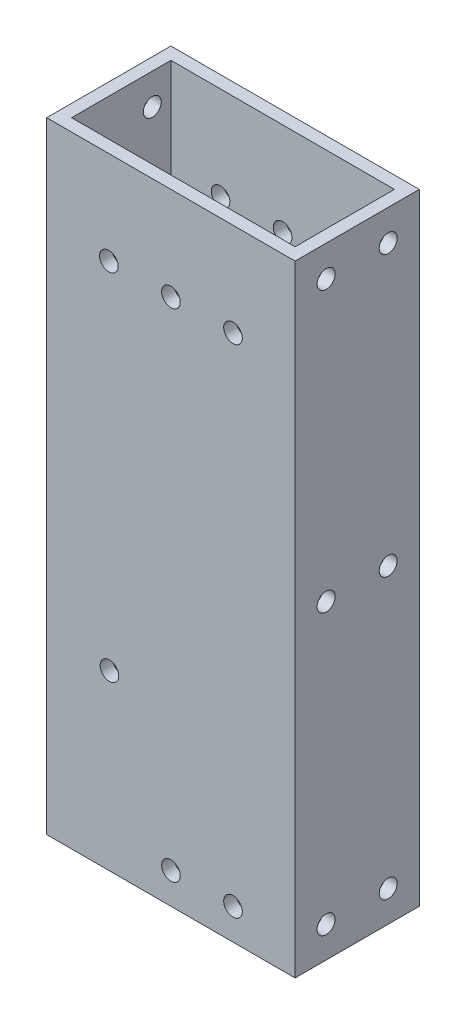
from build123d import *

# Parameters (mm, degrees)
SKETCH_1_W          = 40
SKETCH_1_H          = 20
SKETCH_1_W_2        = 36
SKETCH_1_H_2        = 16
EXTRUDE_1_DEPTH     = 50
SKETCH_2_R          = 1.45
CUT_EXTRUDE_1_DEPTH = 65.807406984
SKETCH_3_R          = 1.5
CUT_EXTRUDE_2_DEPTH = 58.445626465
SKETCH_4_R          = 1.5
CUT_EXTRUDE_3_DEPTH = 58.445626465


with BuildPart() as part:
    # 草图1 → 凸台-拉伸1 (new, symmetric)
    with BuildSketch(Plane(origin=(0, 0, 0), x_dir=(1, 0, 0), z_dir=(0, 1, 0))):
        Rectangle(SKETCH_1_W, SKETCH_1_H)
        Rectangle(SKETCH_1_W_2, SKETCH_1_H_2, mode=Mode.SUBTRACT)
    extrude(amount=EXTRUDE_1_DEPTH, both=True)

    # 草图2 → 切除-拉伸1 (cut, through all)
    with BuildSketch(Plane(origin=(20, 0, 0), x_dir=(0, 0, -1), z_dir=(1, 0, 0))):
        with Locations((5, 45)):
            Circle(SKETCH_2_R)
        with Locations((-5, 45)):
            Circle(SKETCH_2_R)
        with Locations((5, 0)):
            Circle(SKETCH_2_R)
        with Locations((-5, 0)):
            Circle(SKETCH_2_R)
        with Locations((5, -45)):
            Circle(SKETCH_2_R)
        with Locations((-5, -45)):
            Circle(SKETCH_2_R)
    extrude(amount=-CUT_EXTRUDE_1_DEPTH, mode=Mode.SUBTRACT)

    # 草图3 → 切除-拉伸2 (cut, through all)
    with BuildSketch(Plane(origin=(0, 0, -10), x_dir=(-1, 0, 0), z_dir=(0, 0, -1))):
        with Locations((10, 35)):
            Circle(SKETCH_3_R)
        with Locations((0, 35)):
            Circle(SKETCH_3_R)
        with Locations((-10, 35)):
            Circle(SKETCH_3_R)
    extrude(amount=-CUT_EXTRUDE_2_DEPTH, mode=Mode.SUBTRACT)

    # 草图4 → 切除-拉伸3 (cut, through all)
    with BuildSketch(Plane(origin=(0, 0, -10), x_dir=(-1, 0, 0), z_dir=(0, 0, -1))):
        with Locations((0, -45)):
            Circle(SKETCH_4_R)
        with Locations((-10, -45)):
            Circle(SKETCH_4_R)
        with Locations((9.9, -22.0875)):
            Circle(SKETCH_4_R)
    extrude(amount=-CUT_EXTRUDE_3_DEPTH, mode=Mode.SUBTRACT)


solid = part.part
